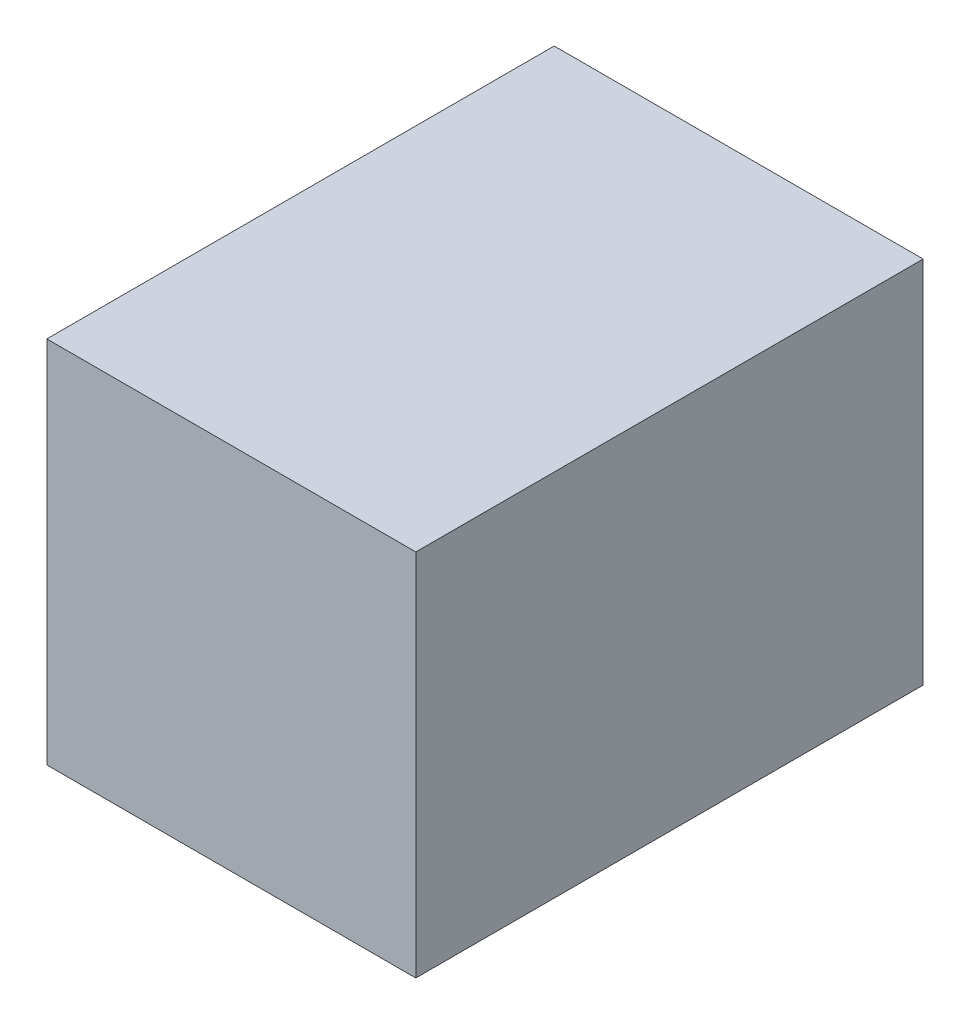
from build123d import *

# Parameters (mm, degrees)
SKETCH1_W           = 25.4
SKETCH1_H           = 25.4
BOSS_EXTRUDE1_DEPTH = 34.925


with BuildPart() as part:
    # Sketch1 → Boss-Extrude1 (new body)
    with BuildSketch(Plane.XY):
        with Locations((12.7, 12.7)):
            Rectangle(SKETCH1_W, SKETCH1_H)
    extrude(amount=BOSS_EXTRUDE1_DEPTH)


solid = part.part
